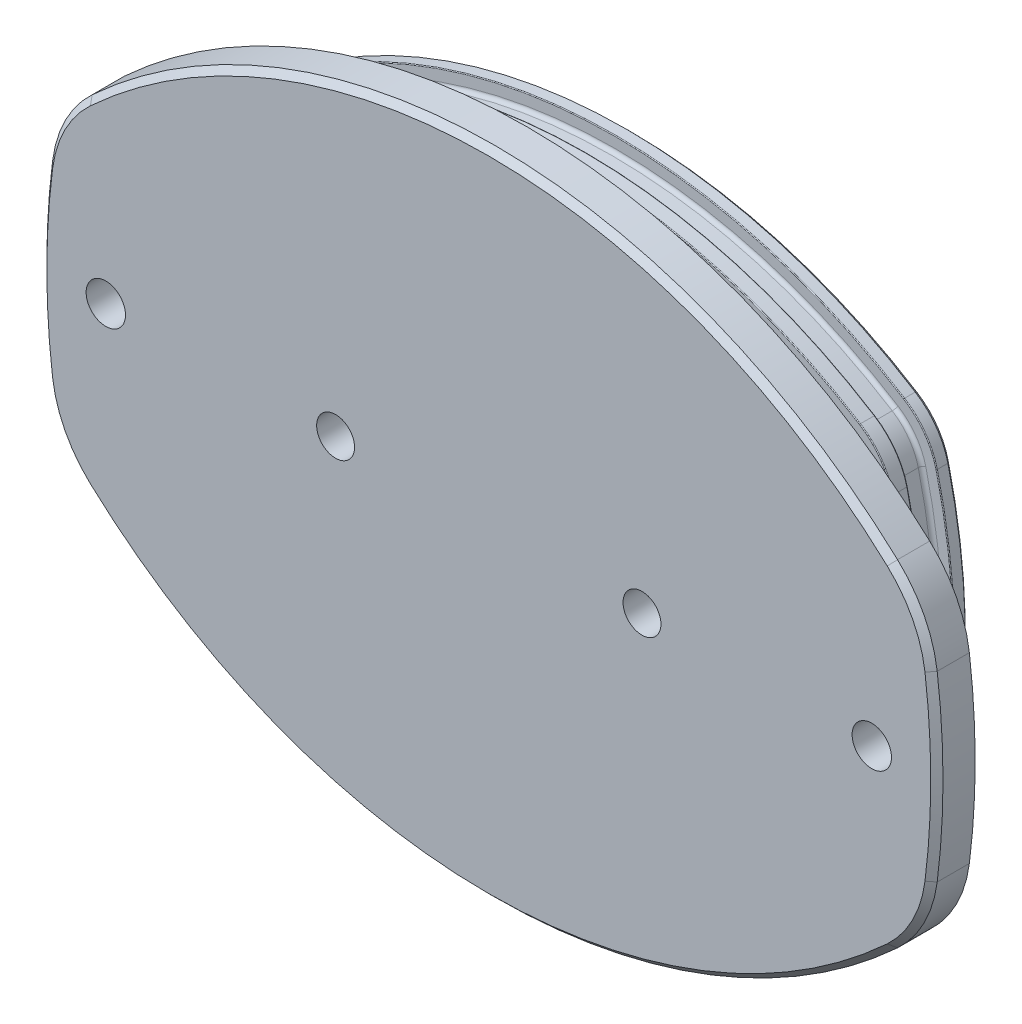
from build123d import *

# Parameters (mm, degrees)
BOSS_EXTRUDE1_DEPTH                         = 6.35
BOSS_EXTRUDE2_DEPTH                         = 17.145
BOSS_EXTRUDE4_START                         = -6.35
BOSS_EXTRUDE4_DEPTH                         = 6.35
CHAMFER1_SIZE                               = 1.016
FILLET2_R                                   = 0.127
FILLET3_R                                   = 0.635
CHAMFER2_SIZE                               = 0.635
F_1_4_CLEARANCE_HOLE1_D                     = 6.5278
SKETCH19_R                                  = 7.9375
BOSS_EXTRUDE5_DEPTH                         = 14.2875
TAPPED_HOLE_FOR_10_24_HELICOIL2_D           = 5.15874
TAPPED_HOLE_FOR_10_24_HELICOIL2_DEPTH       = 14.224
TAPPED_HOLE_FOR_10_24_HELICOIL2_CBORE_D     = 6.2865
TAPPED_HOLE_FOR_10_24_HELICOIL2_CBORE_DEPTH = 12.192
TAPPED_HOLE_FOR_10_24_HELICOIL2_TIP         = 1.549841855


with BuildPart() as part:
    # Sketch1 → Boss-Extrude1 (new body)
    with BuildSketch(Plane.XY):
        with BuildLine():
            ThreePointArc((-61.627673713, 26.086898898), (-64.77, 0), (-61.627673713, -26.086898898))
            ThreePointArc((-61.627673713, -26.086898898), (-58.273728508, -33.360514651), (-52.435835524, -38.844440258))
            ThreePointArc((-52.435835524, -38.844440258), (0, -53.975), (52.435835524, -38.844440258))
            ThreePointArc((52.435835524, -38.844440258), (58.273728508, -33.360514651), (61.627673713, -26.086898898))
            ThreePointArc((61.627673713, -26.086898898), (64.77, 0), (61.627673713, 26.086898898))
            ThreePointArc((61.627673713, 26.086898898), (58.273728508, 33.360514651), (52.435835524, 38.844440258))
            ThreePointArc((52.435835524, 38.844440258), (0, 53.975), (-52.435835524, 38.844440258))
            ThreePointArc((-52.435835524, 38.844440258), (-58.273728508, 33.360514651), (-61.627673713, 26.086898898))
        make_face()
    extrude(amount=BOSS_EXTRUDE1_DEPTH)

    # Sketch2 → Boss-Extrude2 (add)
    with BuildSketch(Plane(origin=(0, 0, 0), x_dir=(-1, 0, 0), z_dir=(0, 0, -1))):
        with BuildLine():
            ThreePointArc((53.608802277, 24.126611698), (51.576108214, 28.534863669), (48.037991254, 31.858454946))
            ThreePointArc((48.037991254, 31.858454946), (0, 45.72), (-48.037991254, 31.858454946))
            ThreePointArc((-48.037991254, 31.858454946), (-51.576108214, 28.534863669), (-53.608802277, 24.126611698))
            ThreePointArc((-53.608802277, 24.126611698), (-56.515, 0), (-53.608802277, -24.126611698))
            ThreePointArc((-53.608802277, -24.126611698), (-51.576108214, -28.534863669), (-48.037991254, -31.858454946))
            ThreePointArc((-48.037991254, -31.858454946), (0, -45.72), (48.037991254, -31.858454946))
            ThreePointArc((48.037991254, -31.858454946), (51.576108214, -28.534863669), (53.608802277, -24.126611698))
            ThreePointArc((53.608802277, -24.126611698), (56.515, 0), (53.608802277, 24.126611698))
        make_face()
        with BuildLine():
            ThreePointArc((-46.044427563, 20.216737054), (-48.26, 0), (-46.044427563, -20.216737054))
            ThreePointArc((-46.044427563, -20.216737054), (-44.569774633, -23.499940123), (-41.914269961, -25.929408911))
            ThreePointArc((-41.914269961, -25.929408911), (0, -37.465), (41.914269961, -25.929408911))
            ThreePointArc((41.914269961, -25.929408911), (44.569774633, -23.499940123), (46.044427563, -20.216737054))
            ThreePointArc((46.044427563, -20.216737054), (48.26, 0), (46.044427563, 20.216737054))
            ThreePointArc((46.044427563, 20.216737054), (44.569774633, 23.499940123), (41.914269961, 25.929408911))
            ThreePointArc((41.914269961, 25.929408911), (0, 37.465), (-41.914269961, 25.929408911))
            ThreePointArc((-41.914269961, 25.929408911), (-44.569774633, 23.499940123), (-46.044427563, 20.216737054))
        make_face(mode=Mode.SUBTRACT)
    extrude(amount=BOSS_EXTRUDE2_DEPTH)

    # Sketch10 → Boss-Extrude4 (add)
    with BuildSketch(Plane.XY.offset(6.35).offset(BOSS_EXTRUDE4_START)):
        with BuildLine():
            ThreePointArc((66.759476201, 27.873253262), (0, 53.975), (-66.759476201, 27.873253262))
            ThreePointArc((-66.759476201, 27.873253262), (-71.169436027, 22.081955779), (-73.332159049, 15.131452104))
            ThreePointArc((-73.332159049, 15.131452104), (-74.295, 0), (-73.332159049, -15.131452104))
            ThreePointArc((-73.332159049, -15.131452104), (-71.169436027, -22.081955779), (-66.759476201, -27.873253262))
            ThreePointArc((-66.759476201, -27.873253262), (0, -53.975), (66.759476201, -27.873253262))
            ThreePointArc((66.759476201, -27.873253262), (71.169436027, -22.081955779), (73.332159049, -15.131452104))
            ThreePointArc((73.332159049, -15.131452104), (74.295, 0), (73.332159049, 15.131452104))
            ThreePointArc((73.332159049, 15.131452104), (71.169436027, 22.081955779), (66.759476201, 27.873253262))
        make_face()
    extrude(amount=BOSS_EXTRUDE4_DEPTH)

    # Chamfer1
    chamfer1_edges = [part.edges().sort_by_distance(p)[0] for p in [
        (0, -53.975, 6.35),
        (0, 53.975, 6.35),
        (-71.169436027, 22.081955779, 6.35),
        (-74.295, 0, 6.35),
        (-71.169436027, -22.081955779, 6.35),
        (71.169436027, -22.081955779, 6.35),
        (74.295, 0, 6.35),
        (71.169436027, 22.081955779, 6.35),
    ]]
    chamfer(chamfer1_edges, length=CHAMFER1_SIZE)

    # Cut-Sweep1: sweep along a path in Sketch9
    with BuildLine(Plane(origin=(0, 0, -17.145), x_dir=(-1, 0, 0), z_dir=(0, 0, -1))) as cut_sweep1_path:
        ThreePointArc((53.608802277, -24.126611698), (56.515, 0), (53.608802277, 24.126611698))
        ThreePointArc((53.608802277, 24.126611698), (51.576108214, 28.534863669), (48.037991254, 31.858454946))
        ThreePointArc((48.037991254, 31.858454946), (0, 45.72), (-48.037991254, 31.858454946))
        ThreePointArc((-48.037991254, 31.858454946), (-51.576108214, 28.534863669), (-53.608802277, 24.126611698))
        ThreePointArc((-53.608802277, 24.126611698), (-56.515, 0), (-53.608802277, -24.126611698))
        ThreePointArc((-53.608802277, -24.126611698), (-51.576108214, -28.534863669), (-48.037991254, -31.858454946))
        ThreePointArc((-48.037991254, -31.858454946), (0, -45.72), (48.037991254, -31.858454946))
        ThreePointArc((48.037991254, -31.858454946), (51.576108214, -28.534863669), (53.608802277, -24.126611698))
    # Sketch8 → Cut-Sweep1 (sweep, cut)
    with BuildSketch(Plane(origin=(0, 0, 0), x_dir=(1, 0, 0), z_dir=(0, 1, 0))):
        Polygon((-56.515, 0), (-56.1594, 0), (-56.1594, 2.497666667), (-53.6702, 2.497666667), (-53.6702, 7.323666667), (-56.1594, 7.323666667), (-56.1594, 9.821333333), (-53.6702, 9.821333333), (-53.6702, 14.647333333), (-56.1594, 14.647333333), (-56.1594, 17.145), (-56.515, 17.145), align=None)
    sweep(path=cut_sweep1_path.line, mode=Mode.SUBTRACT)

    # Fillet2
    fillet2_edges = [part.edges().sort_by_distance(p)[0] for p in [
        (-51.28759534, 28.326989473, -14.647333333),
        (-51.28759534, 28.326989473, -7.323666667),
        (0, 45.3644, -14.647333333),
        (0, 45.3644, -7.323666667),
        (51.28759534, 28.326989473, -14.647333333),
        (51.28759534, 28.326989473, -7.323666667),
        (56.1594, 0, -14.647333333),
        (56.1594, 0, -7.323666667),
        (51.28759534, -28.326989473, -14.647333333),
        (51.28759534, -28.326989473, -7.323666667),
        (0, -45.3644, -14.647333333),
        (0, -45.3644, -7.323666667),
        (-51.28759534, -28.326989473, -14.647333333),
        (-51.28759534, -28.326989473, -7.323666667),
        (-51.28759534, -28.326989473, -2.497666667),
        (0, -45.3644, -2.497666667),
        (51.28759534, -28.326989473, -2.497666667),
        (56.1594, 0, -2.497666667),
        (51.28759534, 28.326989473, -2.497666667),
        (0, 45.3644, -2.497666667),
        (-51.28759534, 28.326989473, -2.497666667),
        (-51.28759534, -28.326989473, -9.821333333),
        (0, -45.3644, -9.821333333),
        (51.28759534, -28.326989473, -9.821333333),
        (56.1594, 0, -9.821333333),
        (51.28759534, 28.326989473, -9.821333333),
        (0, 45.3644, -9.821333333),
        (-51.28759534, 28.326989473, -9.821333333),
    ]]
    fillet(fillet2_edges, radius=FILLET2_R)

    # Fillet3
    fillet3_edges = [part.edges().sort_by_distance(p)[0] for p in [
        (-49.268005221, 26.8718701, -9.821333333),
        (-49.268005221, 26.8718701, -2.497666667),
        (0, 42.8752, -9.821333333),
        (0, 42.8752, -2.497666667),
        (49.268005221, 26.8718701, -9.821333333),
        (49.268005221, 26.8718701, -2.497666667),
        (53.6702, 0, -9.821333333),
        (53.6702, 0, -2.497666667),
        (49.268005221, -26.8718701, -9.821333333),
        (49.268005221, -26.8718701, -2.497666667),
        (0, -42.8752, -9.821333333),
        (0, -42.8752, -2.497666667),
        (-49.268005221, -26.8718701, -9.821333333),
        (-49.268005221, -26.8718701, -2.497666667),
        (-53.6702, 0, -2.497666667),
        (-53.6702, 0, -7.323666667),
        (-49.268005221, -26.8718701, -7.323666667),
        (0, -42.8752, -7.323666667),
        (49.268005221, -26.8718701, -7.323666667),
        (53.6702, 0, -7.323666667),
        (49.268005221, 26.8718701, -7.323666667),
        (0, 42.8752, -7.323666667),
        (-49.268005221, 26.8718701, -7.323666667),
        (-53.6702, 0, -9.821333333),
        (-53.6702, 0, -14.647333333),
        (-49.268005221, -26.8718701, -14.647333333),
        (0, -42.8752, -14.647333333),
        (49.268005221, -26.8718701, -14.647333333),
        (53.6702, 0, -14.647333333),
        (49.268005221, 26.8718701, -14.647333333),
        (0, 42.8752, -14.647333333),
        (-49.268005221, 26.8718701, -14.647333333),
    ]]
    fillet(fillet3_edges, radius=FILLET3_R)

    # Chamfer2
    chamfer2_edges = [part.edges().sort_by_distance(p)[0] for p in [
        (-51.28759534, -28.326989473, -17.145),
        (0, -45.3644, -17.145),
        (51.28759534, -28.326989473, -17.145),
        (56.1594, 0, -17.145),
        (51.28759534, 28.326989473, -17.145),
        (0, 45.3644, -17.145),
        (-51.28759534, 28.326989473, -17.145),
    ]]
    chamfer(chamfer2_edges, length=CHAMFER2_SIZE)

    # 1/4 Clearance Hole1 (through all)
    with Locations(Plane.XY.offset(6.35)):
        with Locations((-63.5, 0), (63.5, 0)):
            Hole(F_1_4_CLEARANCE_HOLE1_D / 2)

    # Sketch19 → Boss-Extrude5 (add)
    with BuildSketch(Plane(origin=(0, 0, 0), x_dir=(-1, 0, 0), z_dir=(0, 0, -1))):
        with Locations(Location((-25.4, 0, 0), (0, 0, 180))):
            Circle(SKETCH19_R)
        with Locations(Location((25.4, 0, 0), (0, 0, 180))):
            Circle(SKETCH19_R)
    extrude(amount=BOSS_EXTRUDE5_DEPTH)

    # Tapped Hole for #10-24 Helicoil2
    with Locations(Plane.XY.offset(6.35)):
        with Locations((-25.4, 0), (25.4, 0)):
            CounterBoreHole(TAPPED_HOLE_FOR_10_24_HELICOIL2_D / 2, TAPPED_HOLE_FOR_10_24_HELICOIL2_CBORE_D / 2, TAPPED_HOLE_FOR_10_24_HELICOIL2_CBORE_DEPTH, depth=TAPPED_HOLE_FOR_10_24_HELICOIL2_DEPTH)
            with Locations((0, 0, -(TAPPED_HOLE_FOR_10_24_HELICOIL2_DEPTH + TAPPED_HOLE_FOR_10_24_HELICOIL2_TIP / 2))):  # 118° drill point
                Cone(0, TAPPED_HOLE_FOR_10_24_HELICOIL2_D / 2, TAPPED_HOLE_FOR_10_24_HELICOIL2_TIP, mode=Mode.SUBTRACT)


solid = part.part
